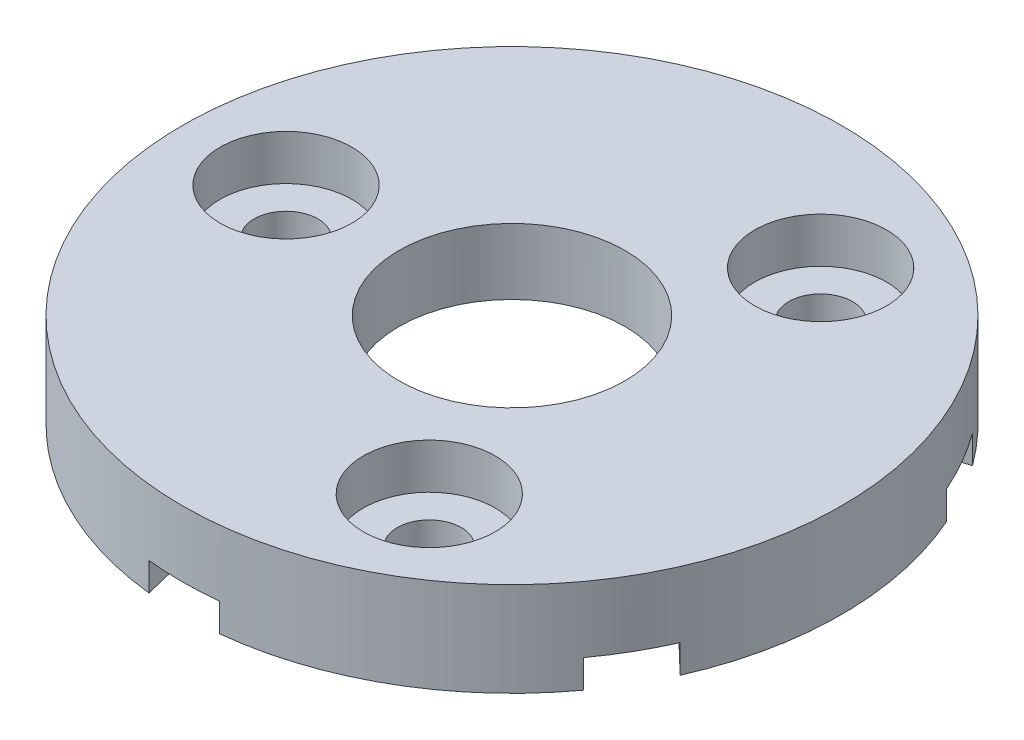
from build123d import *

# Parameters (mm, degrees)
SKETCH1_R                                = 17.5
BOSS_EXTRUDE1_DEPTH                      = 5
CBORE_FOR_M3_PAN_HEAD_SCREW1_D           = 3.4
CBORE_FOR_M3_PAN_HEAD_SCREW1_CBORE_D     = 7
CBORE_FOR_M3_PAN_HEAD_SCREW1_CBORE_DEPTH = 2.4
CIRPATTERN1_COUNT                        = 3
F_12_0_12_DIAMETER_HOLE1_D               = 12
CUT_EXTRUDE1_DEPTH                       = 1.5
CIRPATTERN2_COUNT                        = 6


with BuildPart() as part:
    # Sketch1 → Boss-Extrude1 (new body)
    with BuildSketch(Plane(origin=(0, 0, 0), x_dir=(1, 0, 0), z_dir=(0, 1, 0))):
        with Locations(Location((0, 0, 0), (0, 0, 270))):
            Circle(SKETCH1_R)
    extrude(amount=BOSS_EXTRUDE1_DEPTH)

    # CBORE for M3 Pan Head Screw1 (through all)
    with Locations(Plane(origin=(0, 5, 0), x_dir=(1, 0, 0), z_dir=(0, 1, 0))):
        with Locations((-12, 0)):
            cbore_for_m3_pan_head_screw1 = CounterBoreHole(CBORE_FOR_M3_PAN_HEAD_SCREW1_D / 2, CBORE_FOR_M3_PAN_HEAD_SCREW1_CBORE_D / 2, CBORE_FOR_M3_PAN_HEAD_SCREW1_CBORE_DEPTH)

    # CirPattern1: CBORE for M3 Pan Head Screw1 ×3 about axis
    cirpattern1_axis = Axis((0, 0, 0), (0, 1, 0))
    for i in range(1, CIRPATTERN1_COUNT):
        add(cbore_for_m3_pan_head_screw1.rotate(cirpattern1_axis, i * 360 / CIRPATTERN1_COUNT), mode=Mode.SUBTRACT)

    # Ø12.0 (12) Diameter Hole1 (through all)
    with Locations(Plane(origin=(0, 0, 0), x_dir=(-1, 0, 0), z_dir=(0, -1, 0))):
        with Locations((0, 0)):
            Hole(F_12_0_12_DIAMETER_HOLE1_D / 2)

    # Sketch7 → Cut-Extrude1 (cut)
    with BuildSketch(Plane.XZ):
        Polygon((0, 25), (-5.723634799, 1.800001303), (5.723634799, 1.800001303), align=None)
    cut_extrude1 = extrude(amount=-CUT_EXTRUDE1_DEPTH, mode=Mode.SUBTRACT)

    # CirPattern2: Cut-Extrude1 ×6 about axis
    cirpattern2_axis = Axis((0, 0, 0), (0, 1, 0))
    for i in range(1, CIRPATTERN2_COUNT):
        add(cut_extrude1.rotate(cirpattern2_axis, i * 360 / CIRPATTERN2_COUNT), mode=Mode.SUBTRACT)


solid = part.part
